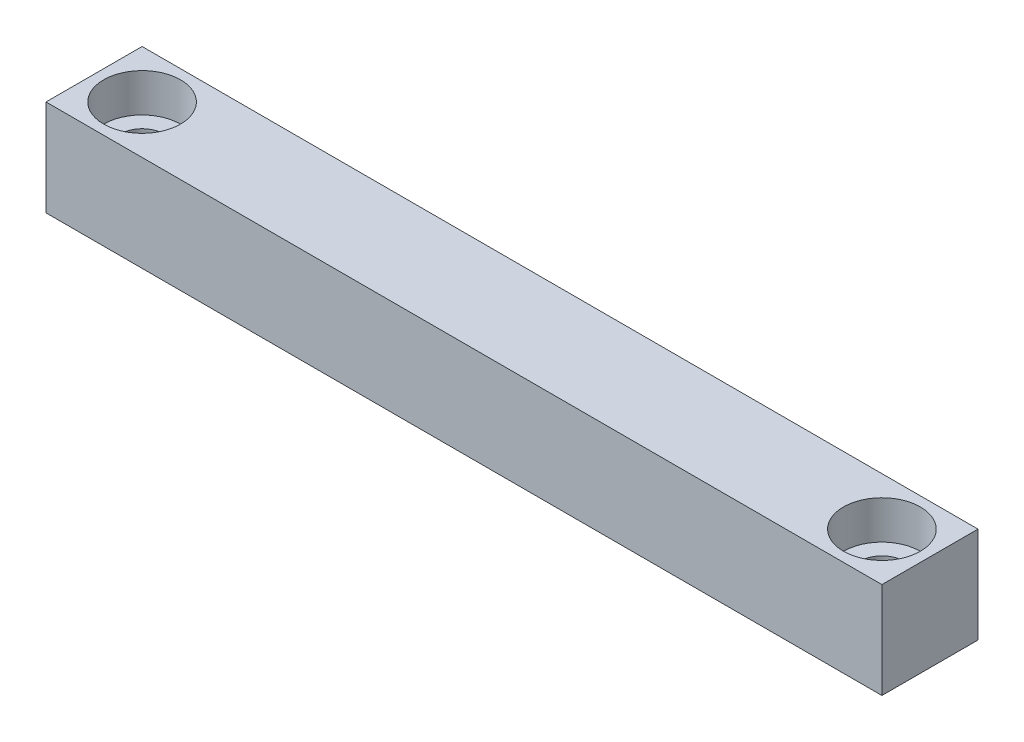
from build123d import *

# Parameters (mm, degrees)
SKETCH1_W                      = 87
SKETCH1_H                      = 10
BOSS_EXTRUDE1_DEPTH            = 10
CBORE_FOR_M4_SHCS2_D           = 4.5
CBORE_FOR_M4_SHCS2_CBORE_D     = 8
CBORE_FOR_M4_SHCS2_CBORE_DEPTH = 4


with BuildPart() as part:
    # Sketch1 → Boss-Extrude1 (new body)
    with BuildSketch(Plane(origin=(0, 0, 0), x_dir=(1, 0, 0), z_dir=(0, 1, 0))):
        Rectangle(SKETCH1_W, SKETCH1_H)
    extrude(amount=BOSS_EXTRUDE1_DEPTH)

    # CBORE for M4 SHCS2 (through all)
    with Locations(Plane(origin=(0, 10, 0), x_dir=(1, 0, 0), z_dir=(0, 1, 0))):
        with Locations((-38.5, 0)):
            cbore_for_m4_shcs2 = CounterBoreHole(CBORE_FOR_M4_SHCS2_D / 2, CBORE_FOR_M4_SHCS2_CBORE_D / 2, CBORE_FOR_M4_SHCS2_CBORE_DEPTH)

    # Mirror3: CBORE for M4 SHCS2 across plane
    add(cbore_for_m4_shcs2.mirror(Plane(origin=(0, 0, 0), x_dir=(0, 0, 1), z_dir=(1, 0, 0))), mode=Mode.SUBTRACT)


solid = part.part
